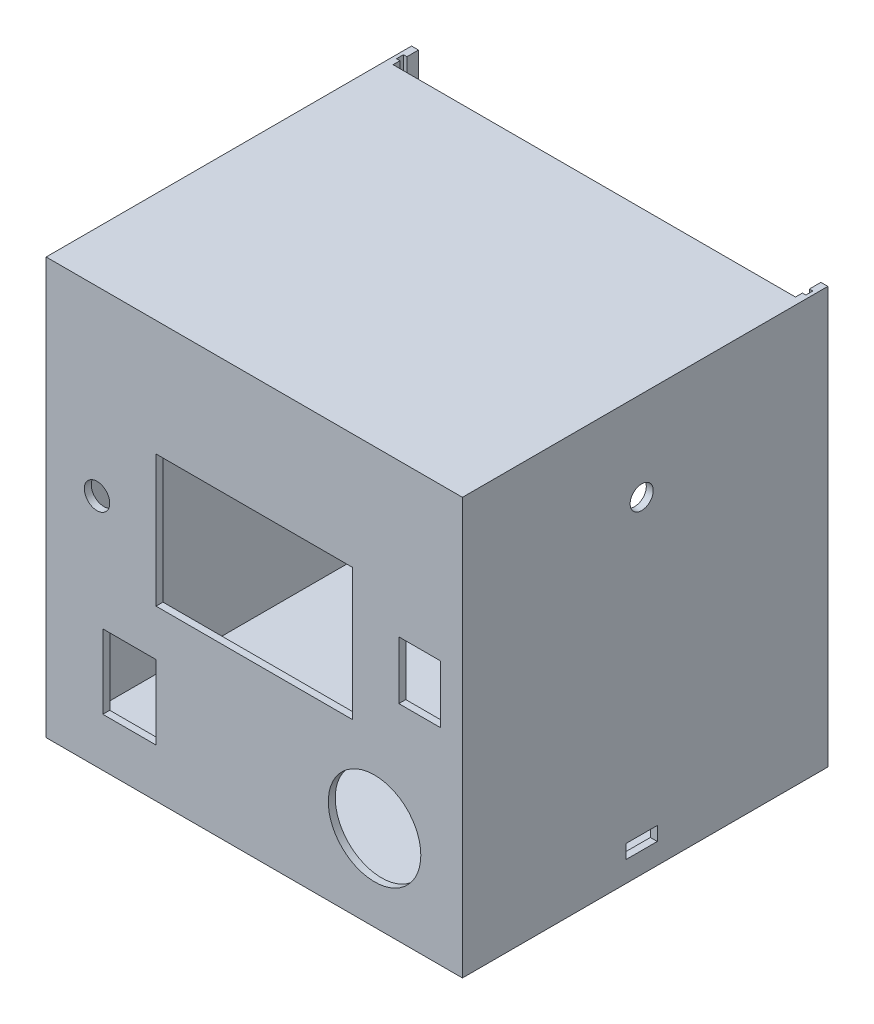
from build123d import *

# Parameters (mm, degrees)
SKETCH2_W           = 23
SKETCH2_H           = 32
SKETCH2_R           = 5.5
SKETCH2_R_2         = 20
SKETCH2_W_2         = 18
SKETCH2_H_2         = 25
BOSS_EXTRUDE1_DEPTH = 3
BOSS_EXTRUDE2_DEPTH = 3
SKETCH4_W           = 180
SKETCH4_H           = 158
BOSS_EXTRUDE3_DEPTH = 3
SKETCH6_W           = 1.5
SKETCH6_H           = 3
CUT_EXTRUDE4_DEPTH  = 177
SKETCH8_W           = 180
SKETCH8_H           = 147
BOSS_EXTRUDE5_DEPTH = 3
SKETCH9_R           = 5
SKETCH9_W           = 13.5
SKETCH9_H           = 6
CUT_EXTRUDE5_DEPTH  = 10


with BuildPart() as part:
    # Sketch2 → Boss-Extrude1 (new body)
    # profile 1 of 2: a face of its own
    with BuildSketch(Plane.XY):
        Polygon((90, 180), (0, 180), (0, 130), (0, 0), (90, 0), (90, 73), (47.5, 73), (47.5, 130), (90, 130), align=None)
        with Locations((36, 37)):
            Rectangle(SKETCH2_W, SKETCH2_H, mode=Mode.SUBTRACT)
        with Locations((22, 101.5)):
            Circle(SKETCH2_R, mode=Mode.SUBTRACT)
    # profile 2 of 2: a face of its own
    with BuildSketch(Plane.XY):
        Polygon((180, 180), (90, 180), (90, 130), (132.5, 130), (132.5, 73), (90, 73), (90, 0), (180, 0), align=None)
        with Locations((142, 37)):
            Circle(SKETCH2_R_2, mode=Mode.SUBTRACT)
        with Locations((161.5, 101.5)):
            Rectangle(SKETCH2_W_2, SKETCH2_H_2, mode=Mode.SUBTRACT)
    extrude(amount=-BOSS_EXTRUDE1_DEPTH)

    # Sketch3 → Boss-Extrude2 (add)
    with BuildSketch(Plane(origin=(0, 0, 0), x_dir=(0, 0, -1), z_dir=(1, 0, 0))):
        Polygon((158, 180), (3, 180), (3, 90), (3, 0), (50, 0), (158, 0), align=None)
    boss_extrude2 = extrude(amount=BOSS_EXTRUDE2_DEPTH)

    # Mirror1: Boss-Extrude2 across plane
    add(boss_extrude2.mirror(Plane(origin=(90, 0, 0), x_dir=(0, 0, 1), z_dir=(1, 0, 0))))

    # Sketch4 → Boss-Extrude3 (add)
    with BuildSketch(Plane(origin=(0, 0, 0), x_dir=(1, 0, 0), z_dir=(0, 1, 0))):
        with Locations((90, 79)):
            Rectangle(SKETCH4_W, SKETCH4_H)
    extrude(amount=BOSS_EXTRUDE3_DEPTH)

    # Sketch6 → Cut-Extrude4 (cut)
    with BuildSketch(Plane(origin=(0, 180, 0), x_dir=(1, 0, 0), z_dir=(0, 1, 0))):
        with Locations((2.25, 151.5)):
            Rectangle(SKETCH6_W, SKETCH6_H)
    cut_extrude4 = extrude(amount=-CUT_EXTRUDE4_DEPTH, mode=Mode.SUBTRACT)

    # Mirror2: Cut-Extrude4 across plane
    add(cut_extrude4.mirror(Plane(origin=(90, 0, 0), x_dir=(0, 0, 1), z_dir=(1, 0, 0))), mode=Mode.SUBTRACT)

    # Sketch8 → Boss-Extrude5 (add)
    with BuildSketch(Plane(origin=(0, 180, 0), x_dir=(1, 0, 0), z_dir=(0, 1, 0))):
        with Locations((90, 73.5)):
            Rectangle(SKETCH8_W, SKETCH8_H)
    extrude(amount=-BOSS_EXTRUDE5_DEPTH)

    # Sketch9 → Cut-Extrude5 (cut)
    with BuildSketch(Plane(origin=(180, 0, 0), x_dir=(0, 0, -1), z_dir=(1, 0, 0))):
        with Locations((77.5, 141.3)):
            Circle(SKETCH9_R)
        with Locations((77.5, 12)):
            Rectangle(SKETCH9_W, SKETCH9_H)
    extrude(amount=-CUT_EXTRUDE5_DEPTH, mode=Mode.SUBTRACT)


solid = part.part
